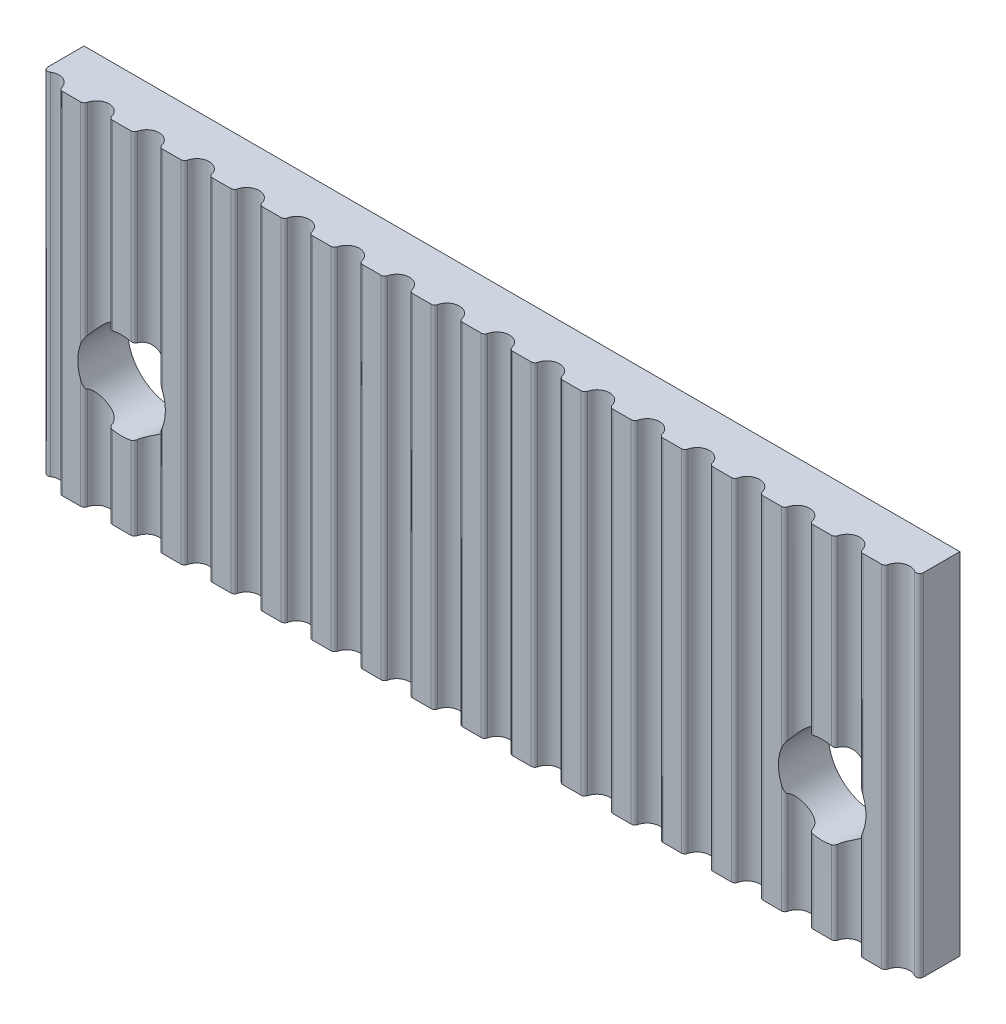
from build123d import *

# Parameters (mm, degrees)
SKETCH1_W           = 35
SKETCH1_H           = 2
BOSS_EXTRUDE1_DEPTH = 14
SKETCH2_R           = 1.75
CUT_EXTRUDE1_DEPTH  = 14
SKETCH3_R           = 0.5
CUT_EXTRUDE2_DEPTH  = 23.433234274
LPATTERN1_COUNT     = 18
LPATTERN1_PITCH     = 2
FILLET1_R           = 0.15


with BuildPart() as part:
    # Sketch1 → Boss-Extrude1 (new body)
    with BuildSketch(Plane(origin=(0, 0, 0), x_dir=(1, 0, 0), z_dir=(0, 1, 0))):
        Rectangle(SKETCH1_W, SKETCH1_H)
    extrude(amount=BOSS_EXTRUDE1_DEPTH)

    # Sketch2 → Cut-Extrude1 (cut)
    with BuildSketch(Plane.XY.offset(1)):
        with Locations((-14, 5)):
            Circle(SKETCH2_R)
        with Locations((14, 5)):
            Circle(SKETCH2_R)
    extrude(amount=-CUT_EXTRUDE1_DEPTH, mode=Mode.SUBTRACT)

    # Sketch3 → Cut-Extrude2 (cut, through all)
    with BuildSketch(Plane(origin=(0, 14, 0), x_dir=(1, 0, 0), z_dir=(0, 1, 0))):
        with Locations((-17, -1)):
            Circle(SKETCH3_R)
    cut_extrude2 = extrude(amount=-CUT_EXTRUDE2_DEPTH, mode=Mode.SUBTRACT)

    # LPattern1: Cut-Extrude2 ×18
    with Locations(*[(i * LPATTERN1_PITCH, 0, 0) for i in range(1, LPATTERN1_COUNT)]):
        add(cut_extrude2, mode=Mode.SUBTRACT)

    # Fillet1
    fillet1_edges = [part.edges().sort_by_distance(p)[0] for p in [
        (-16.5, 7, 1),
        (-17.5, 7, 1),
        (-14.5, 10.338525492, 1),
        (-15.5, 9.950693909, 1),
        (13.5, 1.661474508, 1),
        (12.5, 2.049306091, 1),
        (15.5, 2.049306091, 1),
        (14.5, 1.661474508, 1),
        (17.5, 7, 1),
        (16.5, 7, 1),
        (15.5, 9.950693909, 1),
        (14.5, 10.338525492, 1),
        (13.5, 10.338525492, 1),
        (12.5, 9.950693909, 1),
        (11.5, 7, 1),
        (10.5, 7, 1),
        (9.5, 7, 1),
        (8.5, 7, 1),
        (7.5, 7, 1),
        (6.5, 7, 1),
        (5.5, 7, 1),
        (4.5, 7, 1),
        (3.5, 7, 1),
        (2.5, 7, 1),
        (1.5, 7, 1),
        (0.5, 7, 1),
        (-0.5, 7, 1),
        (-1.5, 7, 1),
        (-2.5, 7, 1),
        (-3.5, 7, 1),
        (-4.5, 7, 1),
        (-5.5, 7, 1),
        (-6.5, 7, 1),
        (-7.5, 7, 1),
        (-8.5, 7, 1),
        (-9.5, 7, 1),
        (-12.5, 9.950693909, 1),
        (-13.5, 10.338525492, 1),
        (-10.5, 7, 1),
        (-11.5, 7, 1),
        (-12.5, 2.049306091, 1),
        (-13.5, 1.661474508, 1),
        (-14.5, 1.661474508, 1),
        (-15.5, 2.049306091, 1),
    ]]
    fillet(fillet1_edges, radius=FILLET1_R)


solid = part.part
